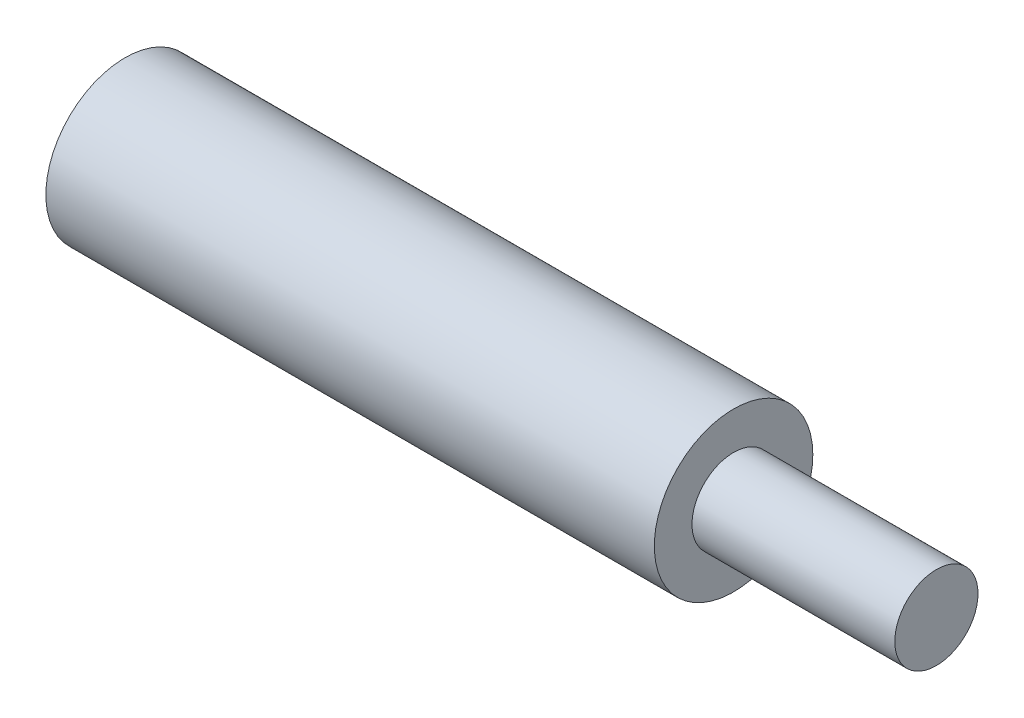
from build123d import *

# Parameters (mm, degrees)
SKETCH1_R           = 20
BOSS_EXTRUDE1_DEPTH = 390
SKETCH2_R           = 38.1
BOSS_EXTRUDE2_DEPTH = 292.5


with BuildPart() as part:
    # Sketch1 → Boss-Extrude1 (new body)
    with BuildSketch(Plane(origin=(0, 0, 0), x_dir=(0, 0, -1), z_dir=(1, 0, 0))):
        Circle(SKETCH1_R)
    extrude(amount=BOSS_EXTRUDE1_DEPTH)

    # Sketch2 → Boss-Extrude2 (add)
    with BuildSketch(Plane(origin=(0, 0, 0), x_dir=(0, 0, -1), z_dir=(1, 0, 0))):
        Circle(SKETCH2_R)
    extrude(amount=BOSS_EXTRUDE2_DEPTH)


solid = part.part
